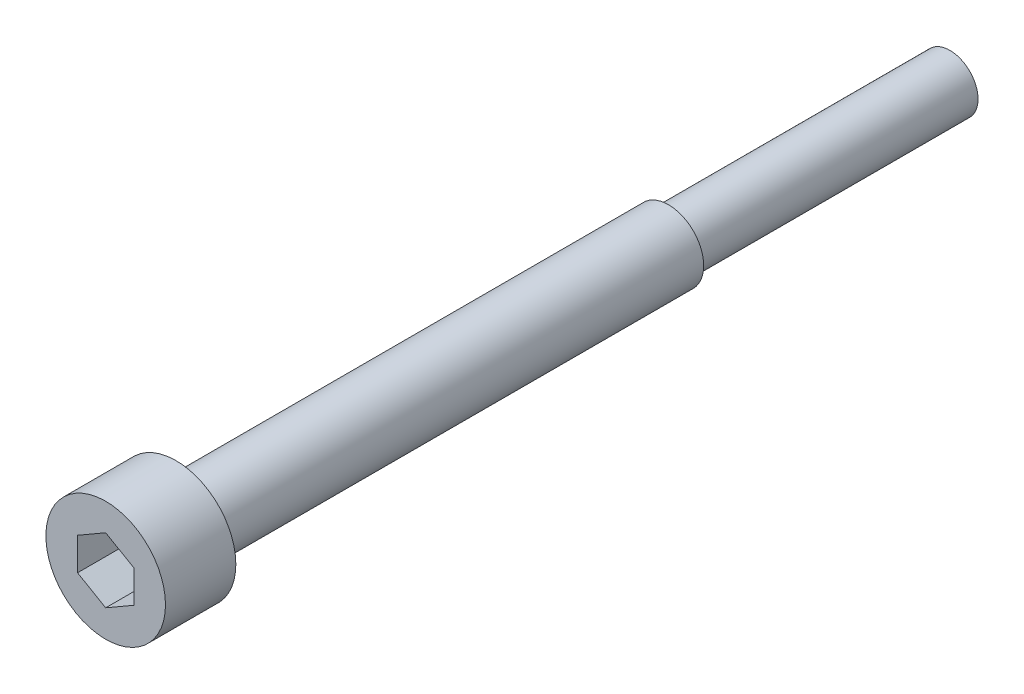
from build123d import *

# Parameters (mm, degrees)
SKETCH_1_R          = 2.5
EXTRUDE_1_DEPTH     = 55
SKETCH_2_R          = 4.25
EXTRUDE_2_DEPTH     = 5
CUT_EXTRUDE_1_DEPTH = 3
SKETCH_4_R          = 2.5
SKETCH_4_R_2        = 2
CUT_EXTRUDE_2_DEPTH = 20


with BuildPart() as part:
    # ｽｹｯﾁ1 → ﾎﾞｽ - 押し出し1 (new body)
    with BuildSketch(Plane.XY):
        Circle(SKETCH_1_R)
    extrude(amount=EXTRUDE_1_DEPTH)

    # ｽｹｯﾁ2 → ﾎﾞｽ - 押し出し2 (add)
    with BuildSketch(Plane.XY.offset(55)):
        Circle(SKETCH_2_R)
    extrude(amount=EXTRUDE_2_DEPTH)

    # ｽｹｯﾁ3 → ｶｯﾄ - 押し出し1 (cut)
    with BuildSketch(Plane.XY.offset(60)):
        Polygon((0, 2.309401077), (-2, 1.154700538), (-2, -1.154700538), (0, -2.309401077), (2, -1.154700538), (2, 1.154700538), align=None)
    extrude(amount=-CUT_EXTRUDE_1_DEPTH, mode=Mode.SUBTRACT)

    # ｽｹｯﾁ4 → ｶｯﾄ - 押し出し2 (cut)
    with BuildSketch(Plane(origin=(0, 0, 0), x_dir=(-1, 0, 0), z_dir=(0, 0, -1))):
        Circle(SKETCH_4_R)
        Circle(SKETCH_4_R_2, mode=Mode.SUBTRACT)
    extrude(amount=-CUT_EXTRUDE_2_DEPTH, mode=Mode.SUBTRACT)


solid = part.part
